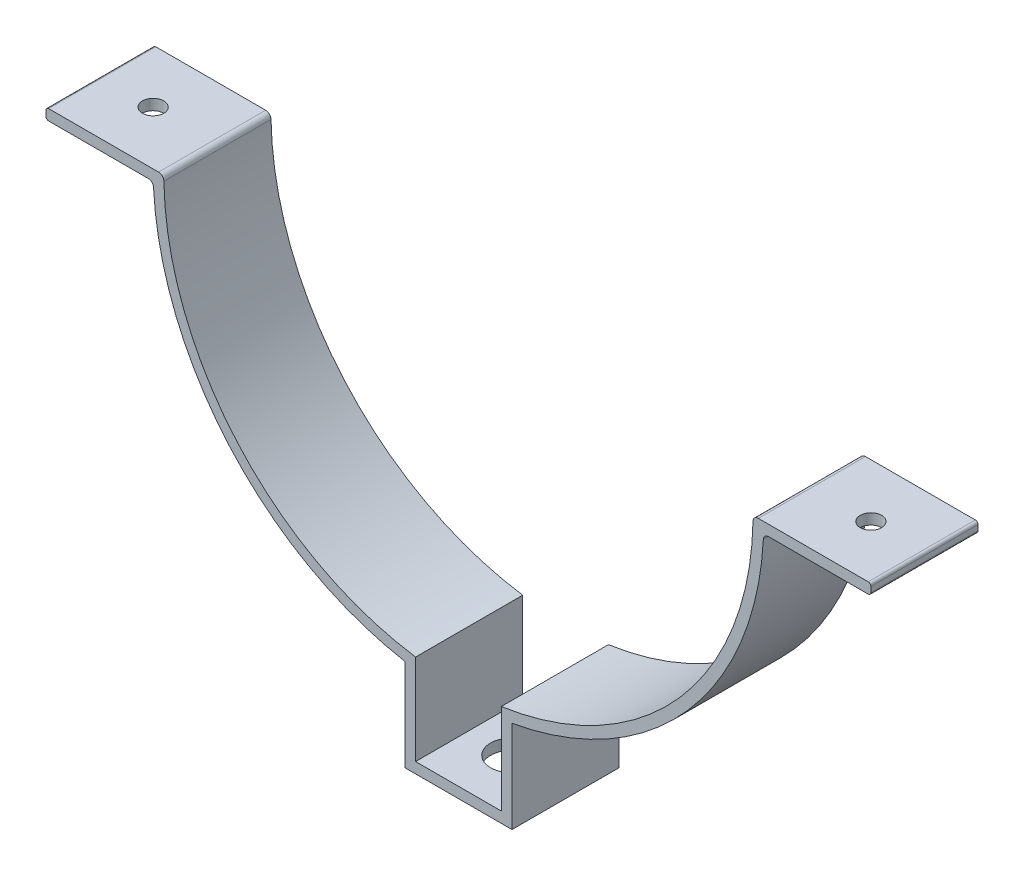
from build123d import *

# Parameters (mm, degrees)
SALIENTE_EXTRUIR2_DEPTH    = 20
CORTAR_EXTRUIR1_DEPTH      = 109.18398602
CORTAR_EXTRUIR1_DEPTH_BACK = 109.18398602
CROQUIS3_R                 = 4
CROQUIS4_R                 = 2
CORTAR_EXTRUIR2_DEPTH      = 109.18398602


with BuildPart() as part:
    # Croquis1 → Saliente-Extruir2 (new body)
    with BuildSketch(Plane.XY):
        with BuildLine():
            Line((-57, 0), (-55.991070717, 0))
            ThreePointArc((-55.991070717, 0), (-55.290305828, -0.286607702), (-54.991230168, -0.982142857))
            ThreePointArc((-54.991230168, -0.982142857), (-41.300644472, -36.32157439), (-8, -54.415071442))
            Line((-8, -54.415071442), (-8, -56.435804238))
            Line((-8, -56.435804238), (-8, -71.312855839))
            Line((-8, -71.312855839), (8, -71.312855839))
            Line((8, -71.312855839), (8, -56.435804238))
            Line((8, -56.435804238), (8, -54.415071442))
            ThreePointArc((8, -54.415071442), (41.300644472, -36.32157439), (54.991230168, -0.982142857))
            ThreePointArc((54.991230168, -0.982142857), (55.290305828, -0.286607702), (55.991070717, 0))
            Line((55.991070717, 0), (57, 0))
            Line((57, 0), (76.5, 0))
            ThreePointArc((76.5, 0), (76.853553391, -0.146446609), (77, -0.5))
            Line((77, -0.5), (77, -1.5))
            ThreePointArc((77, -1.5), (76.853553391, -1.853553391), (76.5, -2))
            Line((76.5, -2), (57.92236183, -2))
            ThreePointArc((57.92236183, -2), (57.233785087, -2.274836523), (56.923700419, -2.948275862))
            ThreePointArc((56.923700419, -2.948275862), (42.736352788, -37.717425023), (10, -56.115951386))
            Line((10, -56.115951386), (10, -73.312855839))
            Line((10, -73.312855839), (-10, -73.312855839))
            Line((-10, -73.312855839), (-10, -56.115951386))
            ThreePointArc((-10, -56.115951386), (-42.736352788, -37.717425023), (-56.923700419, -2.948275862))
            ThreePointArc((-56.923700419, -2.948275862), (-57.233785087, -2.274836523), (-57.92236183, -2))
            Line((-57.92236183, -2), (-76.5, -2))
            ThreePointArc((-76.5, -2), (-76.853553391, -1.853553391), (-77, -1.5))
            Line((-77, -1.5), (-77, -0.5))
            ThreePointArc((-77, -0.5), (-76.853553391, -0.146446609), (-76.5, 0))
            Line((-76.5, 0), (-57, 0))
        make_face()
    extrude(amount=SALIENTE_EXTRUIR2_DEPTH)

    # Croquis3 → Cortar-Extruir1 (cut, two sides: drawn at the far end of the back side and taken through both)
    with BuildSketch(Plane.XZ.offset(73.312855839).offset(-CORTAR_EXTRUIR1_DEPTH_BACK)):
        with Locations(Location((0, 10, 0), (0, 0, 270))):
            Circle(CROQUIS3_R)
    extrude(amount=CORTAR_EXTRUIR1_DEPTH + CORTAR_EXTRUIR1_DEPTH_BACK, mode=Mode.SUBTRACT)

    # Croquis4 → Cortar-Extruir2 (cut, symmetric)
    with BuildSketch(Plane(origin=(0, 0, 0), x_dir=(1, 0, 0), z_dir=(0, 1, 0))):
        with Locations(Location((67, -10, 0), (0, 0, 270))):
            Circle(CROQUIS4_R)
    cortar_extruir2 = extrude(amount=CORTAR_EXTRUIR2_DEPTH, both=True, mode=Mode.SUBTRACT)

    # Simetría1: Cortar-Extruir2 across plane
    add(cortar_extruir2.mirror(Plane(origin=(0, 0, 0), x_dir=(0, 0, 1), z_dir=(1, 0, 0))), mode=Mode.SUBTRACT)


solid = part.part
